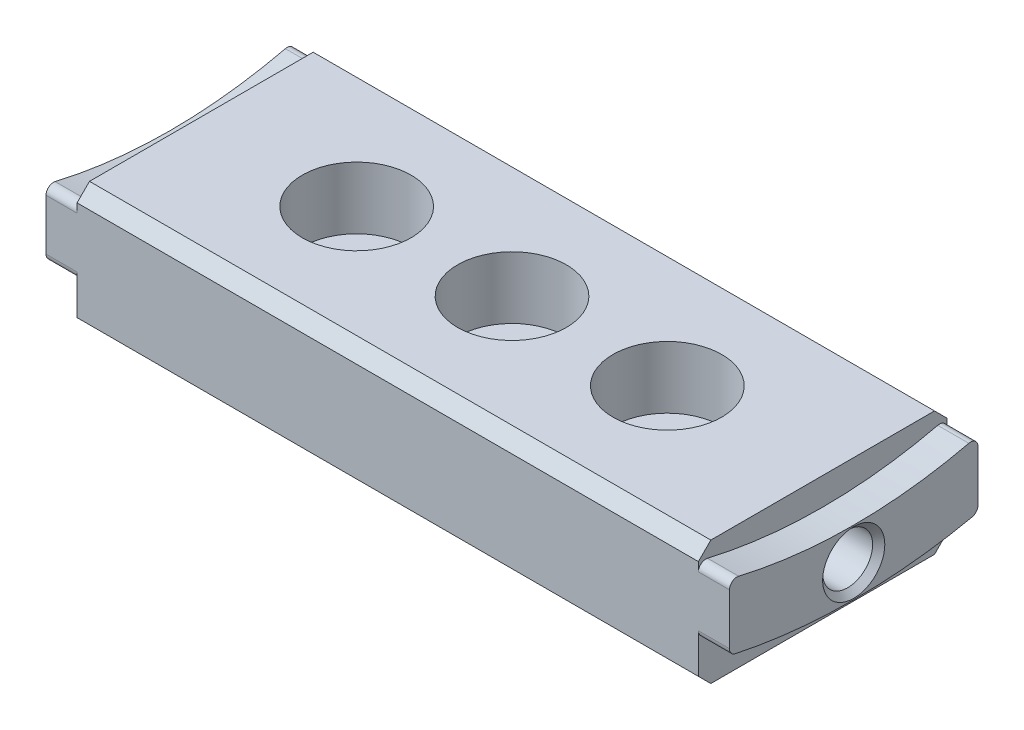
from build123d import *

# Parameters (mm, degrees)
SKETCH1_R                                        = 19.05
BOSS_EXTRUDE1_DEPTH                              = 12.7
CUT_EXTRUDE3_DEPTH                               = 30.784140075
SKETCH8_W                                        = 25.4
SKETCH8_H                                        = 4.850968343
CUT_EXTRUDE4_DEPTH                               = 30.784140075
SKETCH13_OUTSIDE_W                               = 49.628
SKETCH13_OUTSIDE_H                               = 37.157
SKETCH13_OUTSIDE_W_2                             = 25.4
SKETCH13_OUTSIDE_H_2                             = 25.629031657
CUT_EXTRUDE6_DEPTH                               = 27.940768363
SKETCH20_R                                       = 64.3382
CUT_EXTRUDE9_DEPTH                               = 3.175
BOSS_EXTRUDE4_DEPTH                              = 3.175
FILLET4_R                                        = 0.762
FILLET5_R                                        = 0.762
F_1_4_20_TAPPED_HOLE1_D                          = 5.1054
F_1_4_20_TAPPED_HOLE1_DEPTH                      = 9.525
F_1_4_20_TAPPED_HOLE1_CSINK_D                    = 6.35
F_1_4_20_TAPPED_HOLE1_CSINK_ANGLE                = 90
F_1_4_20_TAPPED_HOLE1_TIP                        = 1.533816902
SKETCH18_W                                       = 12.7
SKETCH18_H                                       = 9.525
BOSS_EXTRUDE3_DEPTH                              = 21.59
FILLET3_RADIUS                                   = 6.35
FILLET3_LENGTH                                   = 9.525
SKETCH19_R                                       = 3.175
CUT_EXTRUDE8_DEPTH                               = 42.79813026
SKETCH22_OUTSIDE_W                               = 38.286
SKETCH22_OUTSIDE_H                               = 59.325
SKETCH22_OUTSIDE_W_2                             = 25.4
SKETCH22_OUTSIDE_H_2                             = 19.685
CUT_EXTRUDE10_DEPTH                              = 41.042911819
BOSS_EXTRUDE5_DEPTH                              = 22.225
SKETCH26_OUTSIDE_W                               = 42.778
SKETCH26_OUTSIDE_H                               = 37.063
SKETCH26_OUTSIDE_W_2                             = 25.4
SKETCH26_OUTSIDE_H_2                             = 12.7
CUT_EXTRUDE11_DEPTH                              = 72.71846415
CHAMFER1_SIZE                                    = 1.27
CBORE_FOR_1_4_SOCKET_HEAD_CAP_SCREW1_D           = 6.5278
CBORE_FOR_1_4_SOCKET_HEAD_CAP_SCREW1_CBORE_D     = 11.1125
CBORE_FOR_1_4_SOCKET_HEAD_CAP_SCREW1_CBORE_DEPTH = 6.35


with BuildPart() as part:
    # Sketch1 → Boss-Extrude1 (new body)
    with BuildSketch(Plane(origin=(0, 0, 0), x_dir=(0, 0, -1), z_dir=(1, 0, 0))):
        Circle(SKETCH1_R)
    extrude(amount=BOSS_EXTRUDE1_DEPTH)

    # Sketch4 → Cut-Extrude3 (cut, through all)
    with BuildSketch(Plane(origin=(12.7, 0, 0), x_dir=(0, 0, -1), z_dir=(1, 0, 0))):
        with BuildLine():
            Line((-15.24, 21.59), (15.24, 21.59))
            Line((15.24, 21.59), (15.24, 11.43))
            ThreePointArc((15.24, 11.43), (0, 8.925760466), (-15.24, 11.43))
            Line((-15.24, 11.43), (-15.24, 21.59))
        make_face()
    extrude(amount=-CUT_EXTRUDE3_DEPTH, mode=Mode.SUBTRACT)

    # Sketch8 → Cut-Extrude4 (cut, through all)
    with BuildSketch(Plane.ZY):
        with Locations((0, -16.624515829)):
            Rectangle(SKETCH8_W, SKETCH8_H)
    extrude(amount=-CUT_EXTRUDE4_DEPTH, mode=Mode.SUBTRACT)

    # Sketch13 outside → Cut-Extrude6 (cut, through all)
    with BuildSketch(Plane(origin=(12.7, 0, 0), x_dir=(0, 0, -1), z_dir=(1, 0, 0))):
        with Locations((0, -1.3845)):
            Rectangle(SKETCH13_OUTSIDE_W, SKETCH13_OUTSIDE_H)
        with Locations((0, -1.384515828)):
            Rectangle(SKETCH13_OUTSIDE_W_2, SKETCH13_OUTSIDE_H_2, mode=Mode.SUBTRACT)
    extrude(amount=-CUT_EXTRUDE6_DEPTH, mode=Mode.SUBTRACT)

    # Sketch20 → Cut-Extrude9 (cut)
    with BuildSketch(Plane(origin=(12.7, 0, 0), x_dir=(0, 0, -1), z_dir=(1, 0, 0))):
        with Locations((0, 56.550760466)):
            Circle(SKETCH20_R)
    extrude(amount=-CUT_EXTRUDE9_DEPTH, mode=Mode.SUBTRACT)

    # Sketch21 → Boss-Extrude4 (add)
    with BuildSketch(Plane(origin=(9.525, 0, 0), x_dir=(0, 0, -1), z_dir=(1, 0, 0))):
        with BuildLine():
            Line((-12.7, -0.029636663), (-12.7, 6.760741289))
            ThreePointArc((-12.7, 6.760741289), (0, 5.166560466), (12.7, 6.760741289))
            Line((12.7, 6.760741289), (12.7, -0.029636663))
            ThreePointArc((12.7, -0.029636663), (0, -1.437439534), (-12.7, -0.029636663))
        make_face()
    extrude(amount=BOSS_EXTRUDE4_DEPTH)

    # Fillet4
    fillet4_edges = [part.edges().sort_by_distance(p)[0] for p in [
        (11.1125, -0.029636663, 12.7),
        (11.1125, -0.029636663, -12.7),
        (11.1125, 6.760741289, -12.7),
        (11.1125, 6.760741289, 12.7),
    ]]
    fillet(fillet4_edges, radius=FILLET4_R)

    # Fillet5
    fillet5_edges = [part.edges().sort_by_distance(p)[0] for p in [
        (11.1125, -6.521531226, 12.7),
        (11.1125, -6.521531226, -12.7),
    ]]
    fillet(fillet5_edges, radius=FILLET5_R)

    # 1/4-20 Tapped Hole1
    with Locations(Plane(origin=(12.7, 0, 0), x_dir=(0, 0, -1), z_dir=(1, 0, 0))):
        with Locations((0, 1.864560466)):
            CounterSinkHole(F_1_4_20_TAPPED_HOLE1_D / 2, F_1_4_20_TAPPED_HOLE1_CSINK_D / 2, depth=F_1_4_20_TAPPED_HOLE1_DEPTH, counter_sink_angle=F_1_4_20_TAPPED_HOLE1_CSINK_ANGLE)
            with Locations((0, 0, -(F_1_4_20_TAPPED_HOLE1_DEPTH + F_1_4_20_TAPPED_HOLE1_TIP / 2))):  # 118° drill point
                Cone(0, F_1_4_20_TAPPED_HOLE1_D / 2, F_1_4_20_TAPPED_HOLE1_TIP, mode=Mode.SUBTRACT)

    # Sketch18 → Boss-Extrude3 (add)
    with BuildSketch(Plane.XZ.offset(14.199031657)):
        with Locations((6.35, 0)):
            Rectangle(SKETCH18_W, SKETCH18_H)
    extrude(amount=BOSS_EXTRUDE3_DEPTH)

    # Fillet3: full round fillet: the end face becomes a half cylinder, R = half its width
    fillet3_face = Plane((6.35, -35.789031657, 0), x_dir=(0, 0, -1), z_dir=(0, -1, 0))  # on the end face: x along it, z out of the body
    fillet3_slab = fillet3_face.offset(-FILLET3_RADIUS / 2) * Box(FILLET3_LENGTH, 2 * FILLET3_RADIUS, FILLET3_RADIUS, mode=Mode.PRIVATE)  # the body's end, R deep
    fillet3_round = Plane((6.35, -29.439031657, 0), x_dir=(0, -1, 0), z_dir=(0, 0, -1)) * Cylinder(FILLET3_RADIUS, FILLET3_LENGTH, mode=Mode.PRIVATE)  # its axis R under the face
    add(fillet3_slab - fillet3_round, mode=Mode.SUBTRACT)

    # Sketch19 → Cut-Extrude8 (cut, through all)
    with BuildSketch(Plane.XY.offset(4.7625)):
        with Locations((6.35, -29.439031657)):
            Circle(SKETCH19_R)
    extrude(amount=-CUT_EXTRUDE8_DEPTH, mode=Mode.SUBTRACT)

    # Sketch22 outside → Cut-Extrude10 (cut, through all)
    with BuildSketch(Plane(origin=(12.7, 0, 0), x_dir=(0, 0, -1), z_dir=(1, 0, 0))):
        with Locations((0, -12.5695)):
            Rectangle(SKETCH22_OUTSIDE_W, SKETCH22_OUTSIDE_H)
        with Locations((0, 0.3175)):
            Rectangle(SKETCH22_OUTSIDE_W_2, SKETCH22_OUTSIDE_H_2, mode=Mode.SUBTRACT)
    extrude(amount=-CUT_EXTRUDE10_DEPTH, mode=Mode.SUBTRACT)

    # Sketch23 → Boss-Extrude5 (add)
    with BuildSketch(Plane.ZY):
        with BuildLine():
            Line((-10.77209211, 10.16), (-12.7, 10.16))
            Line((-12.7, 10.16), (-12.7, -9.525))
            Line((-12.7, -9.525), (12.7, -9.525))
            Line((12.7, -9.525), (12.7, 10.16))
            Line((12.7, 10.16), (10.77209211, 10.16))
            ThreePointArc((10.77209211, 10.16), (0, 8.925760466), (-10.77209211, 10.16))
        make_face()
    extrude(amount=BOSS_EXTRUDE5_DEPTH)

    # Mirror1: part across plane


with BuildPart() as part_1:
    add(part.part)
    add(part.part.mirror(Plane(origin=(-22.225, 56.550760466, 0), x_dir=(0, 0, 1), z_dir=(-1, 0, 0))))

    # Sketch26 outside → Cut-Extrude11 (cut, through all)
    with BuildSketch(Plane.ZY.offset(57.15)):
        with Locations((0, 0.3175)):
            Rectangle(SKETCH26_OUTSIDE_W, SKETCH26_OUTSIDE_H)
        with Locations((0, 1.624726526)):
            Rectangle(SKETCH26_OUTSIDE_W_2, SKETCH26_OUTSIDE_H_2, mode=Mode.SUBTRACT)
    extrude(amount=-CUT_EXTRUDE11_DEPTH, mode=Mode.SUBTRACT)

    # Chamfer1
    chamfer1_edges = [part_1.edges().sort_by_distance(p)[0] for p in [
        (-22.225, 7.974726526, -12.7),
        (-22.225, 7.974726526, 12.7),
        (-22.225, -4.725273474, 12.7),
        (-22.225, -4.725273474, -12.7),
    ]]
    chamfer(chamfer1_edges, length=CHAMFER1_SIZE)

    # CBORE for 1/4 Socket Head Cap Screw1 (through all)
    with Locations(Plane(origin=(0, 7.974726526, 0), x_dir=(1, 0, 0), z_dir=(0, 1, 0))):
        with Locations((-22.225, 0), (-38.1, 0), (-6.35, 0)):
            CounterBoreHole(CBORE_FOR_1_4_SOCKET_HEAD_CAP_SCREW1_D / 2, CBORE_FOR_1_4_SOCKET_HEAD_CAP_SCREW1_CBORE_D / 2, CBORE_FOR_1_4_SOCKET_HEAD_CAP_SCREW1_CBORE_DEPTH)


solid = part_1.part
